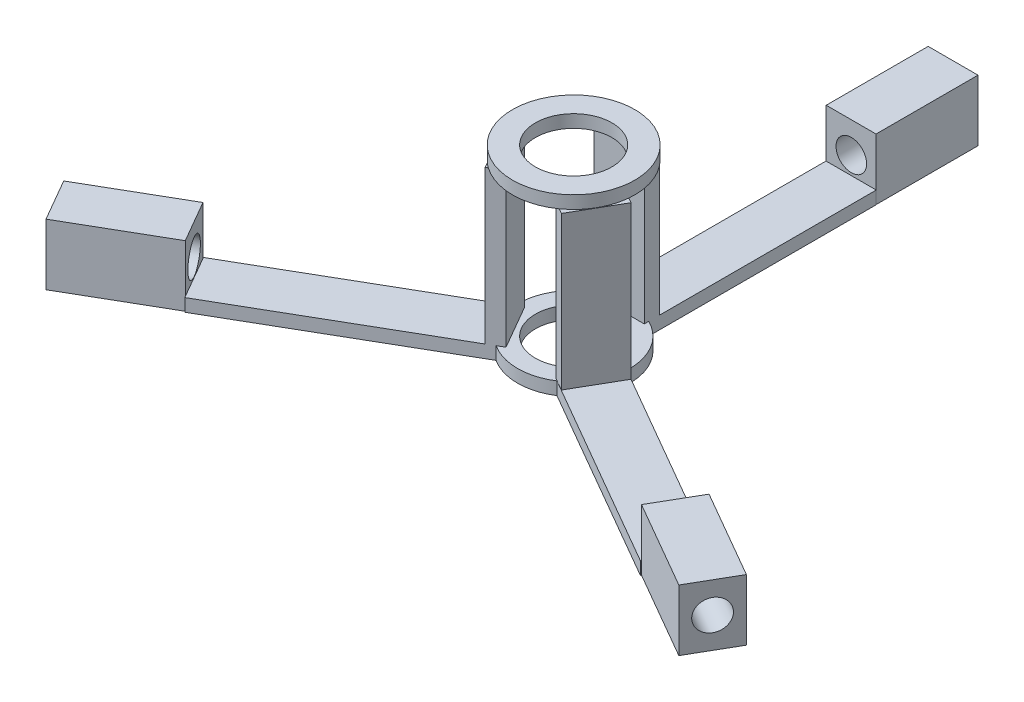
from build123d import *

# Parameters (mm, degrees)
SKETCH1_R                = 5.5
BOSS_EXTRUDE1_DEPTH      = 1.25
SKETCH2_R                = 3.75
CUT_EXTRUDE1_DEPTH       = 1.25
BOSS_EXTRUDE6_DEPTH      = 1.25
SKETCH6_W                = 4.926299948
SKETCH6_H                = 1.5
BOSS_EXTRUDE7_DEPTH      = 15
SKETCH8_R                = 6
BOSS_EXTRUDE8_DEPTH      = 1.25
SKETCH9_R                = 3.75
CUT_EXTRUDE3_DEPTH       = 1.25
BOSS_EXTRUDE9_DEPTH      = 4.75
BOSS_EXTRUDE9_DEPTH_BACK = 1.25
SKETCH10_W               = 4.888756282
SKETCH10_H               = 10
SKETCH11_R               = 1.669068308
CUT_EXTRUDE4_DEPTH       = 10
SKETCH12_R               = 1.5
CUT_EXTRUDE5_DEPTH       = 10
SKETCH13_R               = 1.5
CUT_EXTRUDE6_DEPTH       = 10


with BuildPart() as part:
    # Sketch1 → Boss-Extrude1 (new body)
    with BuildSketch(Plane(origin=(0, 0, 0), x_dir=(1, 0, 0), z_dir=(0, 1, 0))):
        with Locations(Location((0, 0, 0), (0, 0, 270))):
            Circle(SKETCH1_R)
    extrude(amount=BOSS_EXTRUDE1_DEPTH)

    # Sketch2 → Cut-Extrude1 (cut)
    with BuildSketch(Plane(origin=(0, 1.25, 0), x_dir=(1, 0, 0), z_dir=(0, 1, 0))):
        with Locations(Location((0, 0, 0), (0, 0, 270))):
            Circle(SKETCH2_R)
    extrude(amount=-CUT_EXTRUDE1_DEPTH, mode=Mode.SUBTRACT)

    # Sketch3 → Boss-Extrude6 (add)
    with BuildSketch(Plane(origin=(0, 1.25, 0), x_dir=(1, 0, 0), z_dir=(0, 1, 0))):
        Polygon((-2.5, 3.749893265), (0, 3.749893265), (2.426299948, 3.749893265), (2.426299948, 27.250106735), (-2.5, 27.250106735), align=None)
        Polygon((-1.997595264, -4.040063509), (-3.247595264, -1.875), (-4.49106014, 0.278744342), (-24.842657128, -11.471255658), (-22.349192253, -15.790063509), align=None)
        Polygon((4.497595264, 0.290063509), (3.247595264, -1.875), (1.99170365, -4.050268084), (22.343300639, -15.800268084), (24.849192253, -11.459936491), align=None)
    extrude(amount=-BOSS_EXTRUDE6_DEPTH)

    # Sketch6 → Boss-Extrude7 (add)
    with BuildSketch(Plane(origin=(0, 1.25, 0), x_dir=(1, 0, 0), z_dir=(0, 1, 0))):
        with Locations((-0.036850026, 5.250106735)):
            Rectangle(SKETCH6_W, SKETCH6_H)
        Polygon((-6.169311431, -0.690194493), (-3.675846556, -5.009002344), (-2.37680845, -4.259002344), (-4.870273325, 0.059805507), align=None)
        Polygon((3.974013034, -5.181148841), (6.474013034, -0.851021822), (5.174974928, -0.101021822), (2.674974928, -4.431148841), align=None)
    extrude(amount=BOSS_EXTRUDE7_DEPTH)

    # Sketch8 → Boss-Extrude8 (add)
    with BuildSketch(Plane(origin=(0, 16.25, 0), x_dir=(1, 0, 0), z_dir=(0, 1, 0))):
        with Locations(Location((0, 0, 0), (0, 0, 66.147511133))):
            Circle(SKETCH8_R)
    extrude(amount=BOSS_EXTRUDE8_DEPTH)

    # Sketch9 → Cut-Extrude3 (cut)
    with BuildSketch(Plane(origin=(0, 17.5, 0), x_dir=(1, 0, 0), z_dir=(0, 1, 0))):
        with Locations(Location((0, 0, 0), (0, 0, 270))):
            Circle(SKETCH9_R)
    extrude(amount=-CUT_EXTRUDE3_DEPTH, mode=Mode.SUBTRACT)

    # Sketch10 → Boss-Extrude9 (add, two sides: drawn at the far end of the back side and taken through both)
    with BuildSketch(Plane(origin=(0, 1.25, 0), x_dir=(1, 0, 0), z_dir=(0, 1, 0)).offset(-BOSS_EXTRUDE9_DEPTH_BACK)):
        Polygon((-31.069234844, -20.686506698), (-22.408980806, -15.686506698), (-24.782868576, -11.57481247), (-33.443122613, -16.57481247), align=None)
        with Locations((-0.036850026, 32.250106735)):
            Rectangle(SKETCH10_W, SKETCH10_H)
        Polygon((31.044029351, -20.730163892), (22.383775314, -15.730163892), (24.808717579, -11.530040683), (33.468971617, -16.530040683), align=None)
    extrude(amount=BOSS_EXTRUDE9_DEPTH + BOSS_EXTRUDE9_DEPTH_BACK)

    # Sketch11 → Cut-Extrude4 (cut)
    with BuildSketch(Plane(origin=(-32.259446291, 0, 18.625), x_dir=(0.5000000000000004, 0, 0.8660254037844385), z_dir=(-0.8660254037844384, 0, 0.5000000000000003))):
        with Locations((0.006535125, 3)):
            Circle(SKETCH11_R)
    extrude(amount=-CUT_EXTRUDE4_DEPTH, mode=Mode.SUBTRACT)

    # Sketch12 → Cut-Extrude5 (cut)
    with BuildSketch(Plane(origin=(0, 0, -37.250106735), x_dir=(-1, 0, 0), z_dir=(0, 0, -1))):
        with Locations((0.018425013, 3)):
            Circle(SKETCH12_R)
    extrude(amount=-CUT_EXTRUDE5_DEPTH, mode=Mode.SUBTRACT)

    # Sketch13 → Cut-Extrude6 (cut)
    with BuildSketch(Plane(origin=(32.259446291, 0, 18.625), x_dir=(0.4999999999999998, 0, -0.8660254037844388), z_dir=(0.8660254037844388, 0, 0.4999999999999998))):
        with Locations((-0.005891614, 3)):
            Circle(SKETCH13_R)
    extrude(amount=-CUT_EXTRUDE6_DEPTH, mode=Mode.SUBTRACT)


solid = part.part
